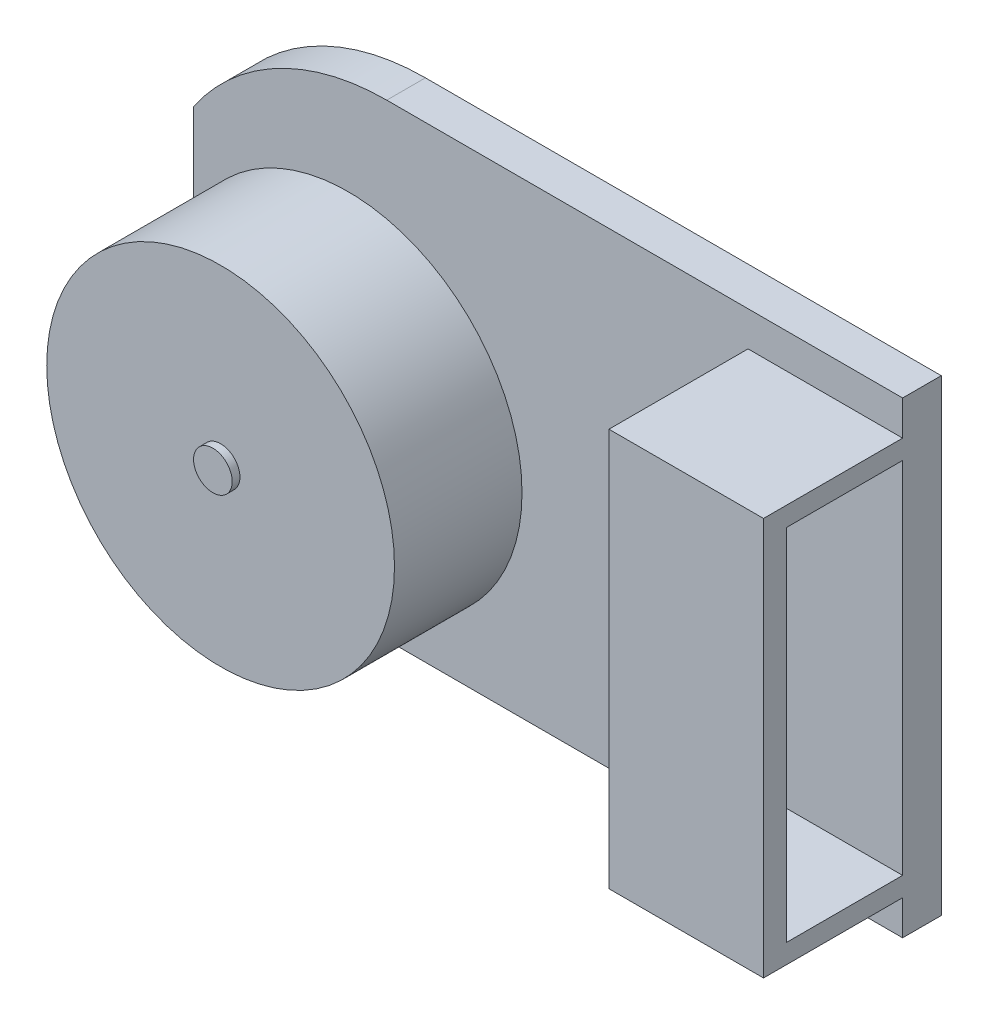
from build123d import *

# Parameters (mm, degrees)
SKETCH_1_R          = 0.5
EXTRUDE_1_DEPTH     = 1
SKETCH_3_R          = 0.5
EXTRUDE_2_DEPTH     = 5.5
SKETCH_4_R          = 4.5
EXTRUDE_3_DEPTH     = 3.3
EXTRUDE_4_DEPTH     = 3.6
SKETCH_6_W          = 3
SKETCH_6_H          = 9.3
SKETCH_6_W_2        = 0.5
CUT_EXTRUDE_1_DEPTH = 3


with BuildPart() as part:
    # 草图1 → 凸台-拉伸1 (new body)
    # profile 1 of 2: a face of its own
    with BuildSketch(Plane.XY):
        with BuildLine():
            Line((5, -3.406244266), (5, 3.406244266))
            ThreePointArc((5, 3.406244266), (0, 6.05), (-5, 3.406244266))
            Line((-5, 3.406244266), (-5, -3.406244266))
            ThreePointArc((-5, -3.406244266), (0, -6.05), (5, -3.406244266))
        make_face()
        Circle(SKETCH_1_R, mode=Mode.SUBTRACT)
    # profile 2 of 2: a face of its own
    with BuildSketch(Plane.XY):
        with BuildLine():
            Line((13.35, 6.05), (0, 6.05))
            ThreePointArc((0, 6.05), (2.827960589, 5.348377222), (5, 3.406244266))
            Line((5, 3.406244266), (5, -3.406244266))
            ThreePointArc((5, -3.406244266), (2.827960589, -5.348377222), (0, -6.05))
            Line((0, -6.05), (13.35, -6.05))
            Line((13.35, -6.05), (13.35, 6.05))
        make_face()
    extrude(amount=EXTRUDE_1_DEPTH)

    # 草图3 → 凸台-拉伸2 (add)
    with BuildSketch(Plane(origin=(0, 0, 0), x_dir=(-1, 0, 0), z_dir=(0, 0, -1))):
        Circle(SKETCH_3_R)
    extrude(amount=-EXTRUDE_2_DEPTH)

    # 草图4 → 凸台-拉伸3 (add)
    with BuildSketch(Plane.XY.offset(2)):
        Circle(SKETCH_4_R)
    extrude(amount=EXTRUDE_3_DEPTH)

    # 草图5 → 凸台-拉伸4 (add)
    with BuildSketch(Plane.XY.offset(1)):
        Polygon((13.35, 0), (13.35, 5.15), (9.35, 5.15), (9.35, -5.15), (13.35, -5.15), align=None)
    extrude(amount=EXTRUDE_4_DEPTH)

    # 草图6 → 切除-拉伸1 (cut)
    with BuildSketch(Plane.XY.offset(1)):
        with Locations((11.35, 0)):
            Rectangle(SKETCH_6_W, SKETCH_6_H)
        with Locations((13.1, 0)):
            Rectangle(SKETCH_6_W_2, SKETCH_6_H)
    extrude(amount=CUT_EXTRUDE_1_DEPTH, mode=Mode.SUBTRACT)


solid = part.part
